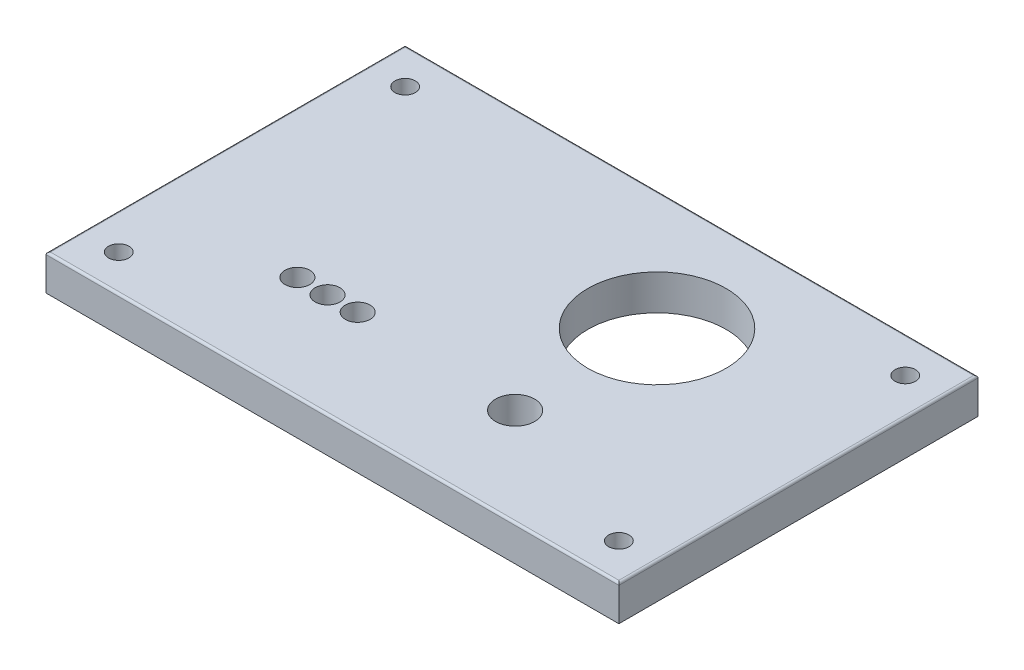
from build123d import *

# Parameters (mm, degrees)
SKETCH1_W           = 64.6
SKETCH1_H           = 40.5
SKETCH1_R           = 7.8
SKETCH1_R_2         = 2.2
SKETCH1_R_3         = 1.4
BOSS_EXTRUDE3_DEPTH = 4
SKETCH6_R           = 1.15
CUT_EXTRUDE4_DEPTH  = 5
FILLET4_R           = 0.25


with BuildPart() as part:
    # Sketch1 → Boss-Extrude3 (new body)
    with BuildSketch(Plane(origin=(0, 0, 0), x_dir=(1, 0, 0), z_dir=(0, 1, 0))):
        Rectangle(SKETCH1_W, SKETCH1_H)
        with Locations(Location((9.6, 6.75, 0), (0, 0, 270))):
            Circle(SKETCH1_R, mode=Mode.SUBTRACT)
        with Locations(Location((9.6, -9.25, 0), (0, 0, 270))):
            Circle(SKETCH1_R_2, mode=Mode.SUBTRACT)
        with Locations(Location((-12.25, -8.55, 0), (0, 0, 270))):
            Circle(SKETCH1_R_3, mode=Mode.SUBTRACT)
        with Locations(Location((-8.85, -8.55, 0), (0, 0, 270))):
            Circle(SKETCH1_R_3, mode=Mode.SUBTRACT)
        with Locations(Location((-15.65, -8.55, 0), (0, 0, 270))):
            Circle(SKETCH1_R_3, mode=Mode.SUBTRACT)
    extrude(amount=BOSS_EXTRUDE3_DEPTH)

    # Sketch6 → Cut-Extrude4 (cut)
    with BuildSketch(Plane(origin=(0, 4, 0), x_dir=(1, 0, 0), z_dir=(0, 1, 0))):
        with Locations(Location((-28.2, 16.15, 0), (0, 0, 270))):
            Circle(SKETCH6_R)
        with Locations(Location((28.2, 16.15, 0), (0, 0, 270))):
            Circle(SKETCH6_R)
        with Locations(Location((28.2, -16.15, 0), (0, 0, 270))):
            Circle(SKETCH6_R)
        with Locations(Location((-28.2, -16.15, 0), (0, 0, 270))):
            Circle(SKETCH6_R)
    extrude(amount=-CUT_EXTRUDE4_DEPTH, mode=Mode.SUBTRACT)

    # Fillet4
    fillet4_edges = [part.edges().sort_by_distance(p)[0] for p in [
        (0, 4, 20.25),
        (32.3, 4, 0),
        (0, 4, -20.25),
        (-32.3, 4, 0),
    ]]
    fillet(fillet4_edges, radius=FILLET4_R)


solid = part.part
